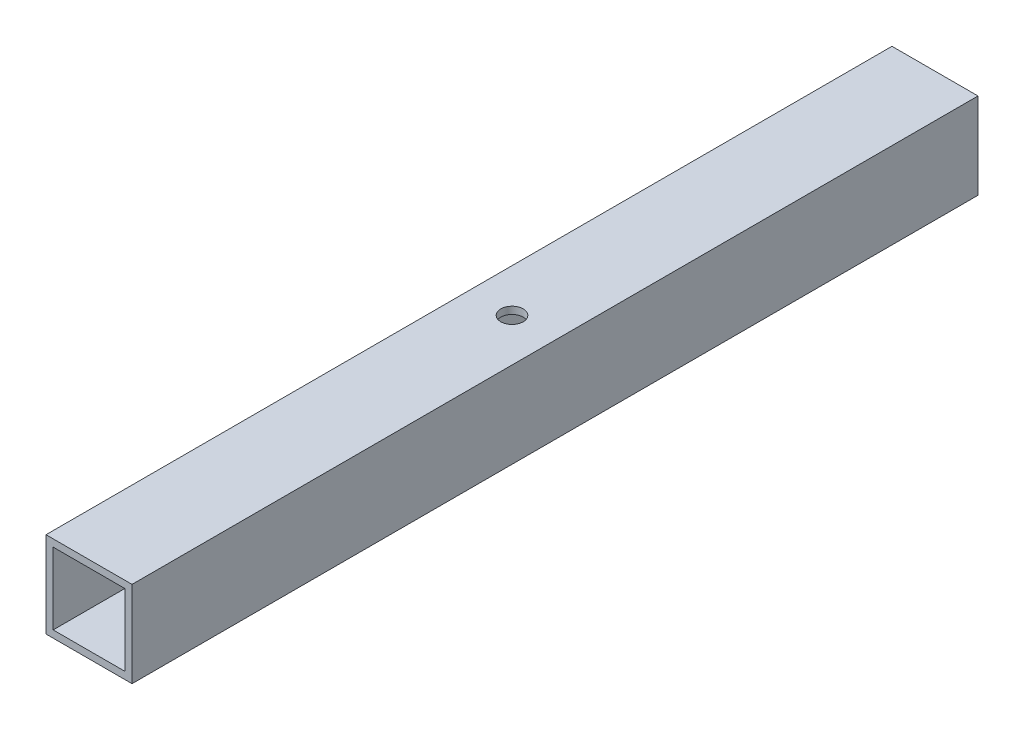
from build123d import *

# Parameters (mm, degrees)
SKETCH1_W                        = 38.1
SKETCH1_H                        = 38.1
SKETCH1_W_2                      = 31.75
SKETCH1_H_2                      = 31.75
BOSS_EXTRUDE1_DEPTH              = 374.65
F_25_64_0_39063_DIAMETER_HOLE1_D = 9.922002


with BuildPart() as part:
    # Sketch1 → Boss-Extrude1 (new body)
    with BuildSketch(Plane.XY):
        Rectangle(SKETCH1_W, SKETCH1_H)
        Rectangle(SKETCH1_W_2, SKETCH1_H_2, mode=Mode.SUBTRACT)
    extrude(amount=BOSS_EXTRUDE1_DEPTH)

    # 25/64 (0.39063) Diameter Hole1 (through all)
    with Locations(Plane(origin=(0, 19.05, 0), x_dir=(1, 0, 0), z_dir=(0, 1, 0))):
        with Locations((0, -187.325)):
            Hole(F_25_64_0_39063_DIAMETER_HOLE1_D / 2)


solid = part.part
